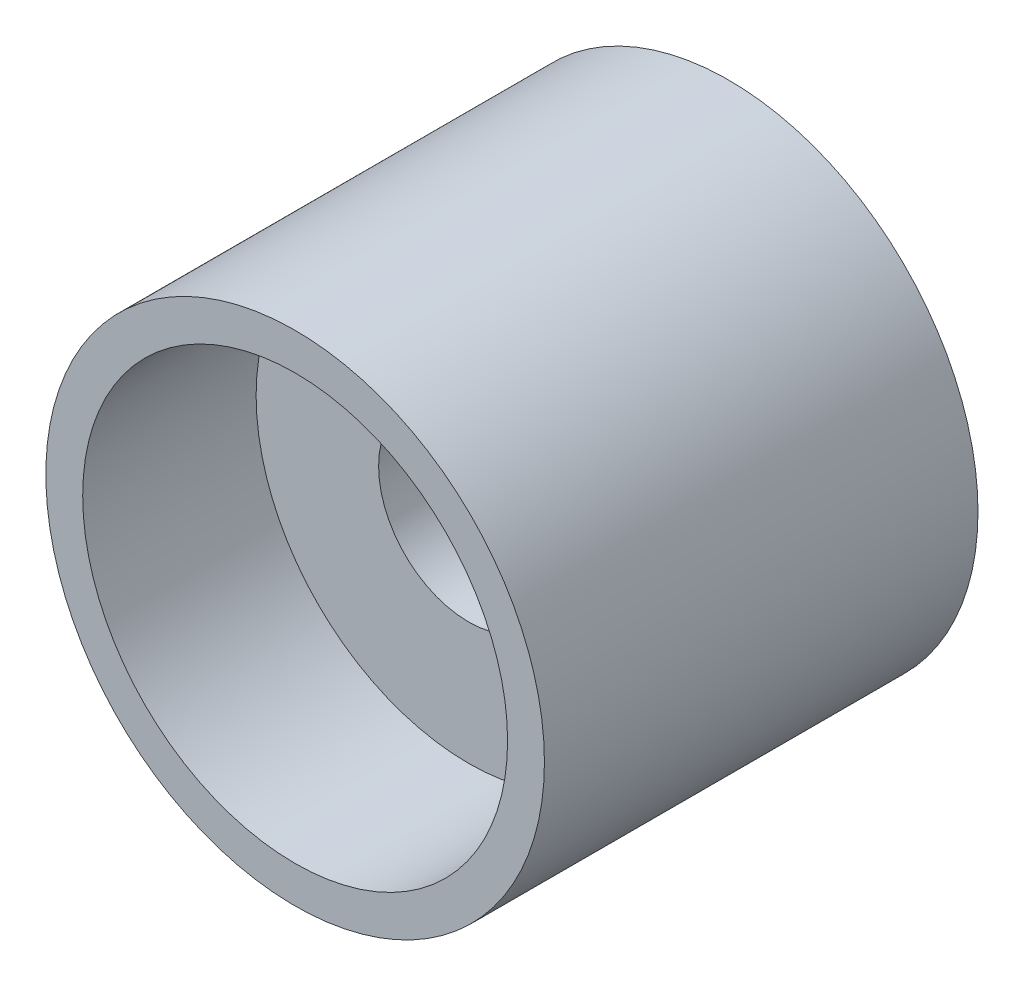
from build123d import *

# Parameters (mm, degrees)
SKETCH1_R           = 11.5
SKETCH1_R_2         = 4.15
BOSS_EXTRUDE1_DEPTH = 20
SKETCH2_R           = 9.8
CUT_EXTRUDE1_DEPTH  = 8


with BuildPart() as part:
    # Sketch1 → Boss-Extrude1 (new body)
    with BuildSketch(Plane.XY):
        Circle(SKETCH1_R)
        Circle(SKETCH1_R_2, mode=Mode.SUBTRACT)
    extrude(amount=BOSS_EXTRUDE1_DEPTH)

    # Sketch2 → Cut-Extrude1 (cut)
    with BuildSketch(Plane.XY.offset(20)):
        Circle(SKETCH2_R)
    extrude(amount=-CUT_EXTRUDE1_DEPTH, mode=Mode.SUBTRACT)


solid = part.part
